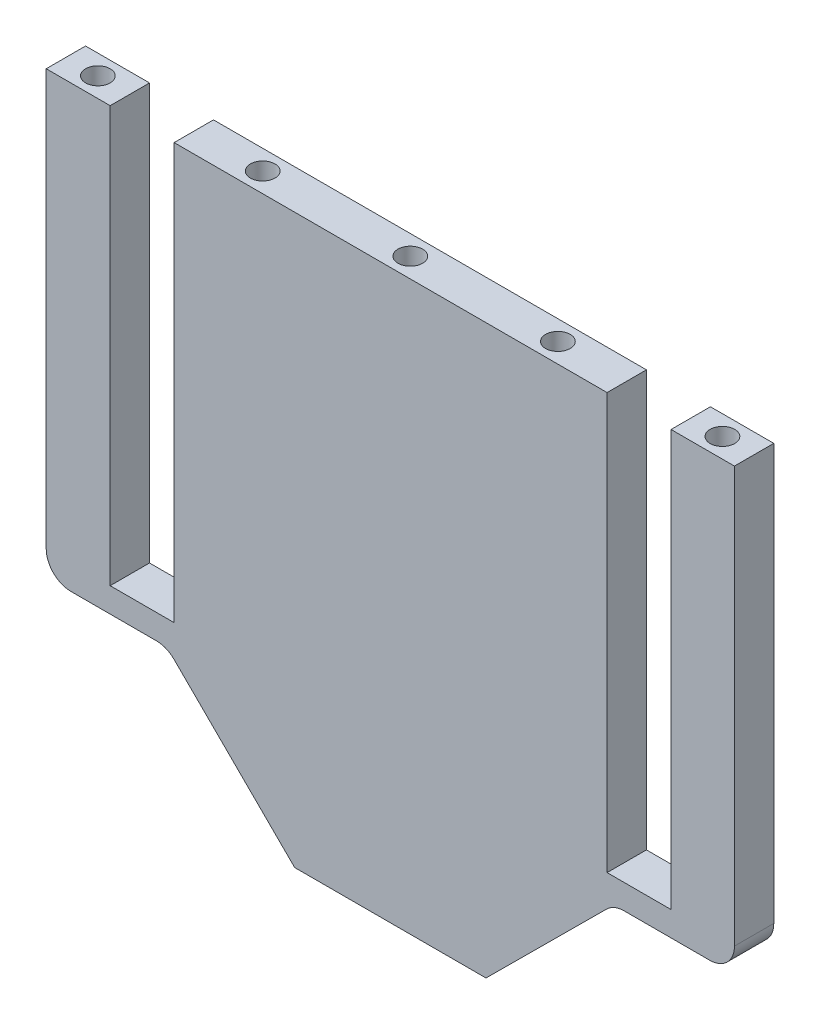
from build123d import *

# Parameters (mm, degrees)
SKETCH1_W              = 13
SKETCH1_H              = 188.148975749
BOSS_EXTRUDE1_DEPTH    = 8
SKETCH2_W              = 45
SKETCH2_H              = 52
CUT_EXTRUDE1_DEPTH     = 341.17998495
SPLIT1_SURFACE_1_BACK  = 341.18
SPLIT1_SURFACE_1_DEPTH = 682.36
SPLIT1_SURFACE_2_BACK  = 341.18
SPLIT1_SURFACE_2_DEPTH = 682.36
SKETCH5_R              = 2.5
CUT_EXTRUDE6_DEPTH     = 5.2
CUT_EXTRUDE7_START     = -5.2
SKETCH4_R              = 2.5
CUT_EXTRUDE7_DEPTH     = 5.2


with BuildPart() as part:
    # Sketch1 → Boss-Extrude1 (new body)
    with BuildSketch(Plane.XY):
        with BuildLine():
            Line((0, 30.859943174), (0, 219.008918923))
            ThreePointArc((0, 219.008918923), (0.311003468, 220.744808182), (1.205324608, 222.264750409))
            Line((1.205324608, 222.264750409), (42.261389271, 270.115641625))
            ThreePointArc((42.261389271, 270.115641625), (42.81710491, 270.906904614), (43.210130369, 271.790334282))
            Line((43.210130369, 271.790334282), (54.802396658, 306.567133147))
            ThreePointArc((54.802396658, 306.567133147), (56.605292439, 309.029920375), (59.503914938, 309.985818768))
            Line((59.503914938, 309.985818768), (80.378944352, 309.985818768))
            ThreePointArc((80.378944352, 309.985818768), (83.277566851, 309.029920375), (85.080462632, 306.567133147))
            Line((85.080462632, 306.567133147), (96.672728921, 271.790334282))
            ThreePointArc((96.672728921, 271.790334282), (97.06575438, 270.906904614), (97.621470019, 270.115641625))
            Line((97.621470019, 270.115641625), (138.677534682, 222.264750409))
            ThreePointArc((138.677534682, 222.264750409), (139.571855822, 220.744808182), (139.88285929, 219.008918923))
            Line((139.88285929, 219.008918923), (139.88285929, 30.859943174))
            ThreePointArc((139.88285929, 30.859943174), (138.418393196, 27.324409268), (134.88285929, 25.859943174))
            Line((134.88285929, 25.859943174), (117.446021446, 25.859943174))
            ThreePointArc((117.446021446, 25.859943174), (115.538843756, 25.481920377), (113.920048724, 24.405012478))
            Line((113.920048724, 24.405012478), (89.38285929, 0))
            Line((89.38285929, 0), (50.5, 0))
            Line((50.5, 0), (25.962810565, 24.405012478))
            ThreePointArc((25.962810565, 24.405012478), (24.344015534, 25.481920377), (22.436837844, 25.859943174))
            Line((22.436837844, 25.859943174), (5, 25.859943174))
            ThreePointArc((5, 25.859943174), (1.464466094, 27.324409268), (0, 30.859943174))
        make_face()
        with Locations((19.5, 124.934431049)):
            Rectangle(SKETCH1_W, SKETCH1_H, mode=Mode.SUBTRACT)
        with Locations((120.5, 124.934431049)):
            Rectangle(SKETCH1_W, SKETCH1_H, mode=Mode.SUBTRACT)
    extrude(amount=BOSS_EXTRUDE1_DEPTH)

    # Sketch2 → Cut-Extrude1 (cut, through all)
    with BuildSketch(Plane.XY.offset(8)):
        with Locations((69.88285929, 180.008918923)):
            Rectangle(SKETCH2_W, SKETCH2_H)
    extrude(amount=-CUT_EXTRUDE1_DEPTH, mode=Mode.SUBTRACT)


with BuildPart() as body_2:
    # Split1: the piece behind the surface
    add(part.part)
    # Split1 surface: a surface, the sketch's curves swept straight by 682.36 mm
    with BuildLine(Plane(origin=(0, 0, 0), x_dir=(-1, 0, 0), z_dir=(0, 0, -1)).offset(-SPLIT1_SURFACE_1_BACK), mode=Mode.PRIVATE) as split1_surface_1_path:
        Line((0, 115.359943174), (-139.88285929, 115.359943174))
    split1_surface_1 = Shell.extrude(split1_surface_1_path.wire(), (0 * SPLIT1_SURFACE_1_DEPTH, 0 * SPLIT1_SURFACE_1_DEPTH, -1 * SPLIT1_SURFACE_1_DEPTH))
    split(bisect_by=split1_surface_1, keep=Keep.BOTTOM)


with BuildPart() as part_1:
    add(part.part)

    # Split1: split by a surface, the side it looks to stays
    # Split1 surface: a surface, the sketch's curves swept straight by 682.36 mm
    with BuildLine(Plane(origin=(0, 0, 0), x_dir=(-1, 0, 0), z_dir=(0, 0, -1)).offset(-SPLIT1_SURFACE_2_BACK), mode=Mode.PRIVATE) as split1_surface_2_path:
        Line((0, 115.359943174), (-139.88285929, 115.359943174))
    split1_surface_2 = Shell.extrude(split1_surface_2_path.wire(), (0 * SPLIT1_SURFACE_2_DEPTH, 0 * SPLIT1_SURFACE_2_DEPTH, -1 * SPLIT1_SURFACE_2_DEPTH))
    split(bisect_by=split1_surface_2, keep=Keep.TOP)

    # Sketch5 → Cut-Extrude6 (cut)
    with BuildSketch(Plane(origin=(0, 115.359943174, -115.359943174), x_dir=(1, 0, 0), z_dir=(0, -1, 0))):
        with Locations(Location((133.441429645, 119.359943174, 0), (0, 0, 270))):
            Circle(SKETCH5_R)
        with Locations(Location((70, 119.359943174, 0), (0, 0, 270))):
            Circle(SKETCH5_R)
        with Locations(Location((100, 119.359943174, 0), (0, 0, 270))):
            Circle(SKETCH5_R)
        with Locations(Location((40, 119.359943174, 0), (0, 0, 270))):
            Circle(SKETCH5_R)
        with Locations(Location((6.5, 119.359943174, 0), (0, 0, 270))):
            Circle(SKETCH5_R)
    extrude(amount=CUT_EXTRUDE6_DEPTH, mode=Mode.SUBTRACT)


with BuildPart() as body_2_1:
    # Body-Move/Copy1: moved
    add(body_2.part.moved(Location((0, 34.793425009, 0))))

    # Sketch4 → Cut-Extrude7 (cut)
    with BuildSketch(Plane(origin=(0, 150.153368183, 0), x_dir=(-1, 0, 0), z_dir=(0, -1, 0)).offset(CUT_EXTRUDE7_START)):
        with Locations(Location((-6.5, -4, 0), (0, 0, 90))):
            Circle(SKETCH4_R)
        with Locations(Location((-70, -4, 0), (0, 0, 90))):
            Circle(SKETCH4_R)
        with Locations(Location((-40, -4, 0), (0, 0, 90))):
            Circle(SKETCH4_R)
        with Locations(Location((-100, -4, 0), (0, 0, 90))):
            Circle(SKETCH4_R)
        with Locations(Location((-133.441429645, -4, 0), (0, 0, 90))):
            Circle(SKETCH4_R)
    extrude(amount=CUT_EXTRUDE7_DEPTH, mode=Mode.SUBTRACT)


solid = part_1.part
